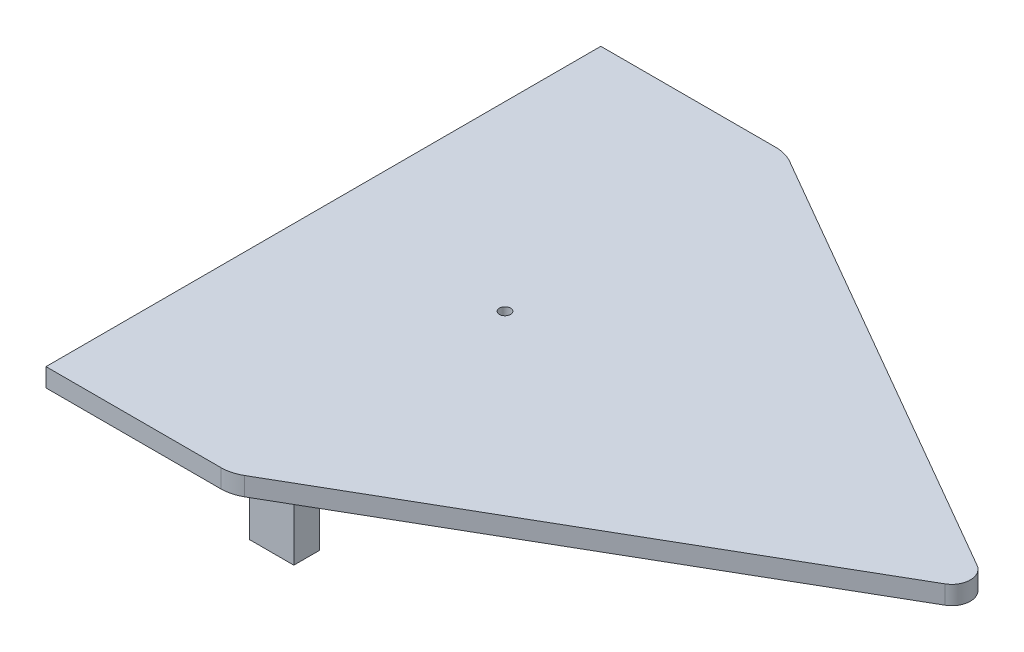
from build123d import *

# Parameters (mm, degrees)
BOSS_EXTRUDE1_DEPTH  = 5
FILLET1_R            = 5
FILLET2_R            = 10
FILLET3_R            = 10
SKETCH3_R            = 1.5
CUT_EXTRUDE1_DEPTH   = 3.5
SKETCH5_W            = 12
SKETCH5_H            = 7
BOSS_EXTRUDE2_DEPTH  = 48
FILLET4_R            = 10
SKETCH6_W            = 4
SKETCH6_H            = 4
CUT_EXTRUDE2_DEPTH   = 30
FILLET4_OF_MIRROR1_R = 10


with BuildPart() as part:
    # Sketch1 → Boss-Extrude1 (new body)
    with BuildSketch(Plane(origin=(0, 0, 0), x_dir=(1, 0, 0), z_dir=(0, 1, 0))):
        Polygon((75.055534995, 0), (-54.848275573, 75), (-104.848275573, 75), (-104.848275573, -75), (-54.848275573, -75), align=None)
    extrude(amount=BOSS_EXTRUDE1_DEPTH)

    # Fillet1
    fillet1_edges = [part.edges().sort_by_distance(p)[0] for p in [
        (75.055534995, 2.5, 0),
    ]]
    fillet(fillet1_edges, radius=FILLET1_R)

    # Fillet2
    fillet2_edges = [part.edges().sort_by_distance(p)[0] for p in [
        (-54.848275573, 2.5, -75),
    ]]
    fillet(fillet2_edges, radius=FILLET2_R)

    # Fillet3
    fillet3_edges = [part.edges().sort_by_distance(p)[0] for p in [
        (-54.848275573, 2.5, 75),
    ]]
    fillet(fillet3_edges, radius=FILLET3_R)

    # Sketch3 → Cut-Extrude1 (cut)
    with BuildSketch(Plane(origin=(0, 5, 0), x_dir=(1, 0, 0), z_dir=(0, 1, 0))):
        with Locations(Location((-55.754465005, 0, 0), (0, 0, 270))):
            Circle(SKETCH3_R)
    extrude(amount=-CUT_EXTRUDE1_DEPTH, mode=Mode.SUBTRACT)

    # Sketch5 → Boss-Extrude2 (add)
    with BuildSketch(Plane.XZ):
        with Locations((-83.848275573, -31.5)):
            Rectangle(SKETCH5_W, SKETCH5_H)
    boss_extrude2 = extrude(amount=BOSS_EXTRUDE2_DEPTH)

    # Fillet4
    fillet4_edges = [part.edges().sort_by_distance(p)[0] for p in [
        (-89.848275573, 0, -31.5),
        (-83.848275573, 0, -35),
        (-77.848275573, 0, -31.5),
        (-83.848275573, 0, -28),
    ]]
    fillet(fillet4_edges, radius=FILLET4_R)

    # Sketch6 → Cut-Extrude2 (cut)
    with BuildSketch(Plane.XZ.offset(48)):
        with Locations((-83.848275573, -29)):
            Rectangle(SKETCH6_W, SKETCH6_H)
    cut_extrude2 = extrude(amount=-CUT_EXTRUDE2_DEPTH, mode=Mode.SUBTRACT)

    # Mirror1: Boss-Extrude2, Cut-Extrude2 across plane
    add(boss_extrude2.mirror(Plane.XY))
    add(cut_extrude2.mirror(Plane.XY), mode=Mode.SUBTRACT)

    # Fillet4 of Mirror1
    fillet4_of_mirror1_edges = [part.edges().sort_by_distance(p)[0] for p in [
        (-89.848275573, 0, 31.5),
        (-83.848275573, 0, 35),
        (-77.848275573, 0, 31.5),
        (-83.848275573, 0, 28),
    ]]
    fillet(fillet4_of_mirror1_edges, radius=FILLET4_OF_MIRROR1_R)


solid = part.part
